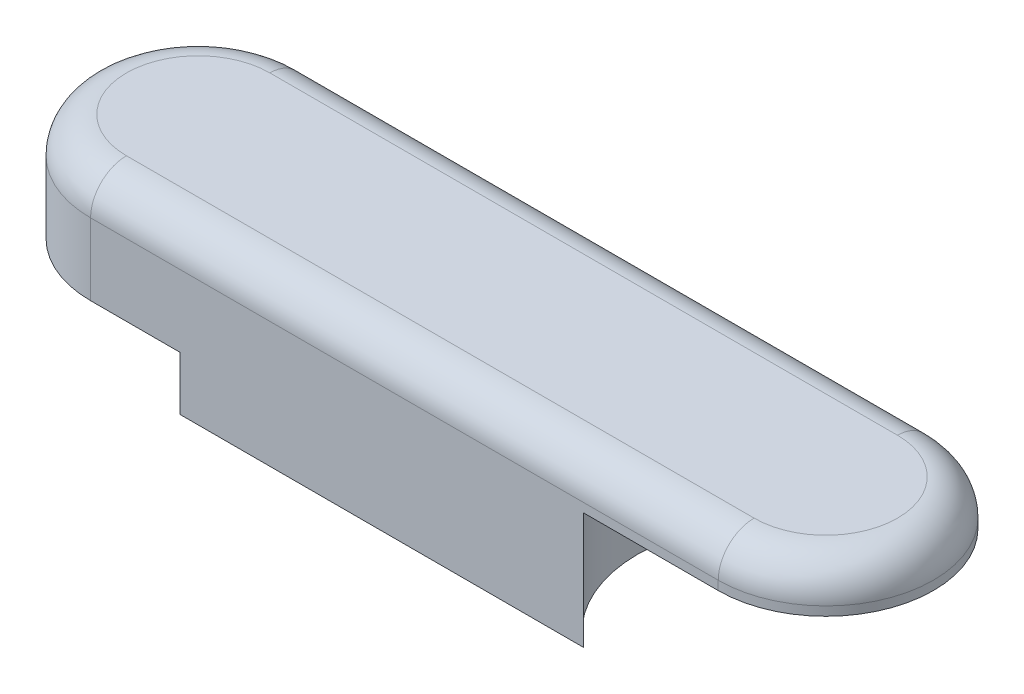
from build123d import *

# Parameters (mm, degrees)
AUFSATZ_LINEAR_AUSTRAGEN1_DEPTH      = 45
AUFSATZ_LINEAR_AUSTRAGEN1_DEPTH_BACK = 45
SKIZZE3_W                            = 90
SKIZZE3_H                            = 65
SCHNITT_LINEAR_AUSTRAGEN1_DEPTH      = 120
SKIZZE4_R                            = 25
AUFSATZ_LINEAR_AUSTRAGEN2_DEPTH      = 20
SCHNITT_LINEAR_AUSTRAGEN2_DEPTH      = 65
SKIZZE6_W                            = 110
SKIZZE6_H                            = 30
SCHNITT_LINEAR_AUSTRAGEN3_DEPTH      = 120
SCHNITT_LINEAR_AUSTRAGEN4_DEPTH      = 30
SKIZZE8_R                            = 30
AUFSATZ_LINEAR_AUSTRAGEN3_DEPTH      = 15
VERRUNDUNG1_R                        = 20


with BuildPart() as part:
    # Skizze2 → Aufsatz-Linear austragen1 (new, two sides: drawn at the far end of the back side and taken through both)
    with BuildSketch(Plane(origin=(0, 0, 0), x_dir=(1, 0, 0), z_dir=(0, 1, 0)).offset(-AUFSATZ_LINEAR_AUSTRAGEN1_DEPTH_BACK)):
        with BuildLine():
            Line((-350, -60), (0, -60))
            ThreePointArc((0, -60), (60, 0), (0, 60))
            Line((0, 60), (-350, 60))
            ThreePointArc((-350, 60), (-410, 0), (-350, -60))
        make_face()
    extrude(amount=AUFSATZ_LINEAR_AUSTRAGEN1_DEPTH + AUFSATZ_LINEAR_AUSTRAGEN1_DEPTH_BACK)

    # Skizze3 → Schnitt-Linear austragen1 (cut)
    with BuildSketch(Plane.XY.offset(60)):
        with Locations((15, -12.5)):
            Rectangle(SKIZZE3_W, SKIZZE3_H)
    extrude(amount=-SCHNITT_LINEAR_AUSTRAGEN1_DEPTH, mode=Mode.SUBTRACT)

    # Skizze4 → Aufsatz-Linear austragen2 (add)
    with BuildSketch(Plane.XZ.offset(-20)):
        with Locations(Location((0, 0, 0), (0, 0, 180))):
            Circle(SKIZZE4_R)
    extrude(amount=AUFSATZ_LINEAR_AUSTRAGEN2_DEPTH)

    # Skizze5 → Schnitt-Linear austragen2 (cut)
    with BuildSketch(Plane.XZ.offset(45)):
        with BuildLine():
            Line((-30, 75), (-30, -75))
            ThreePointArc((-30, -75), (-105, 0), (-30, 75))
        make_face()
    extrude(amount=-SCHNITT_LINEAR_AUSTRAGEN2_DEPTH, mode=Mode.SUBTRACT)

    # Skizze6 → Schnitt-Linear austragen3 (cut)
    with BuildSketch(Plane.XY.offset(60)):
        with Locations((-355, -30)):
            Rectangle(SKIZZE6_W, SKIZZE6_H)
    extrude(amount=-SCHNITT_LINEAR_AUSTRAGEN3_DEPTH, mode=Mode.SUBTRACT)

    # Skizze7 → Schnitt-Linear austragen4 (cut)
    with BuildSketch(Plane(origin=(0, -45, 0), x_dir=(-1, 0, 0), z_dir=(0, -1, 0))):
        with BuildLine():
            Line((300, -60), (300, 60))
            ThreePointArc((300, 60), (240, 0), (300, -60))
        make_face()
    extrude(amount=-SCHNITT_LINEAR_AUSTRAGEN4_DEPTH, mode=Mode.SUBTRACT)

    # Skizze8 → Aufsatz-Linear austragen3 (add)
    with BuildSketch(Plane(origin=(0, -15, 0), x_dir=(-1, 0, 0), z_dir=(0, -1, 0))):
        with Locations(Location((350, 0, 0), (0, 0, 270))):
            Circle(SKIZZE8_R)
    extrude(amount=AUFSATZ_LINEAR_AUSTRAGEN3_DEPTH)

    # Verrundung1
    verrundung1_edges = [part.edges().sort_by_distance(p)[0] for p in [
        (-175, 45, 60),
        (-175, 45, -60),
        (-410, 45, 0),
        (60, 45, 0),
    ]]
    fillet(verrundung1_edges, radius=VERRUNDUNG1_R)


solid = part.part
